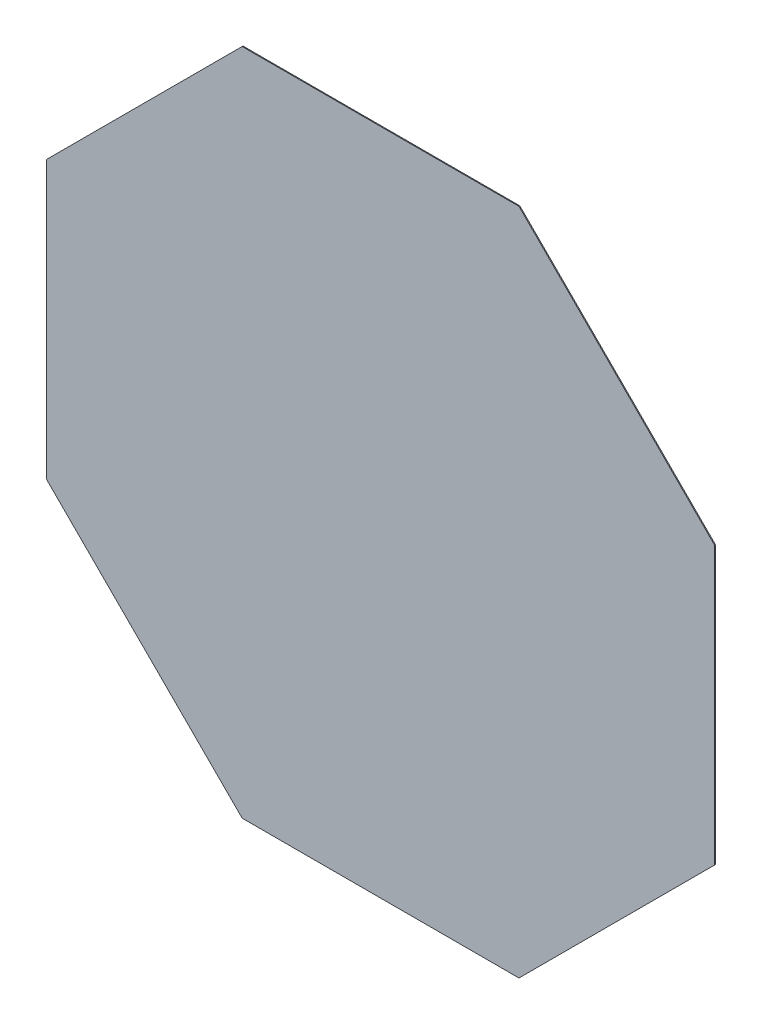
from build123d import *

# Parameters (mm, degrees)
BOSS_EXTRUDE1_DEPTH = 0.065


with BuildPart() as part:
    # Sketch1 → Boss-Extrude1 (new body)
    with BuildSketch(Plane.XY):
        Polygon((-10.355339059, -25), (10.355339059, -25), (25, -10.355339059), (25, 10.355339059), (10.355339059, 25), (-10.355339059, 25), (-25, 10.355339059), (-25, -10.355339059), align=None)
    extrude(amount=BOSS_EXTRUDE1_DEPTH)


solid = part.part
